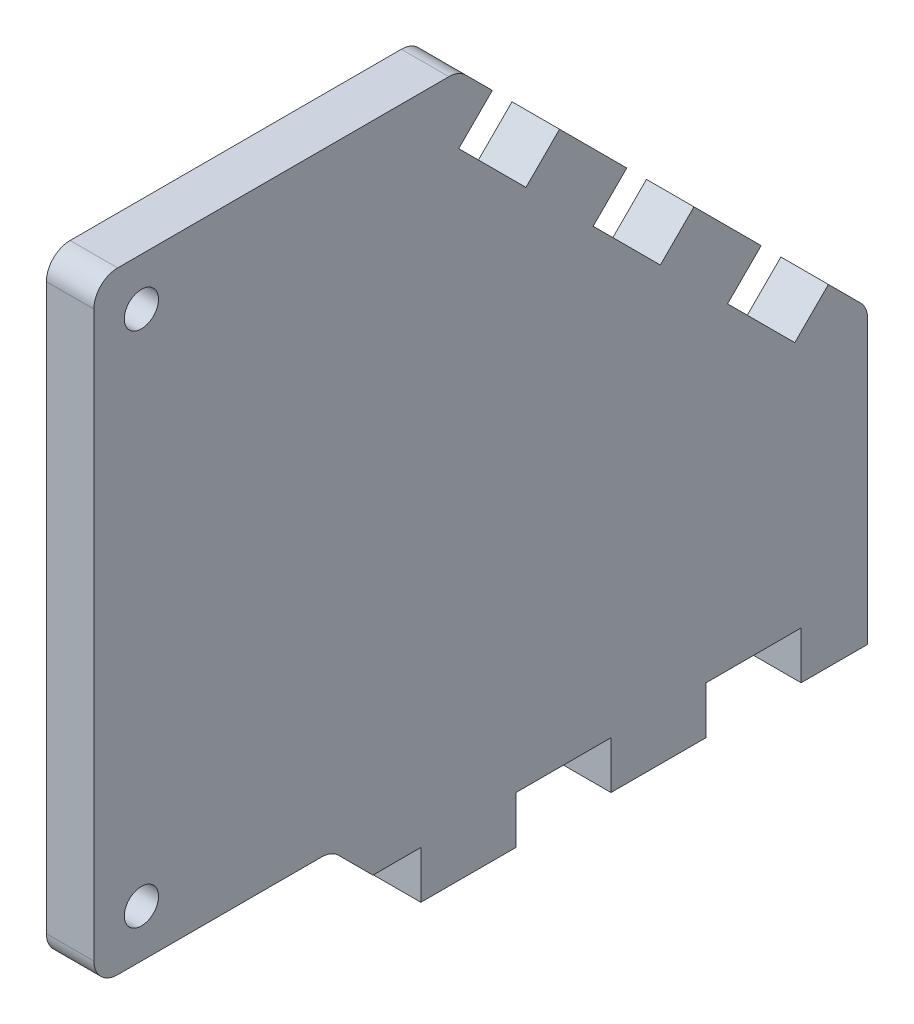
from build123d import *

# Parameters (mm, degrees)
SKETCH2_R           = 2.286
MAIN_DEPTH          = 6.35
SKETCH5_W           = 12.7
SKETCH5_H           = 6.35
SKETCH5_H_2         = 35.219317332
ACRYLIC_JOINT_DEPTH = 123.31992325
SKETCH6_W           = 3.81
SKETCH6_H           = 39.029317332
CUT_EXTRUDE1_DEPTH  = 123.31992325
FILLET4_R           = 3.175


with BuildPart() as part:
    # Sketch2 → Main (new body)
    with BuildSketch(Plane(origin=(0, 0, 0), x_dir=(0, 0, -1), z_dir=(1, 0, 0))):
        Polygon((-67.818, 101.6), (-67.818, 19.812), (-36.068, 19.812), (-29.718, 13.462), (-29.718, 7.9375), (-24.1935, 7.9375), (45.72, 7.9375), (52.07, 7.9375), (52.07, 30.456817332), (-19.073182668, 101.6), (-55.118, 101.6), align=None)
        with Locations((-61.468, 26.162)):
            Circle(SKETCH2_R, mode=Mode.SUBTRACT)
        with Locations((-61.468, 95.25)):
            Circle(SKETCH2_R, mode=Mode.SUBTRACT)
    extrude(amount=MAIN_DEPTH)

    # Sketch5 → Acrylic Joint (cut, through all)
    with BuildSketch(Plane(origin=(6.35, 0, 0), x_dir=(0, 0, -1), z_dir=(1, 0, 0))):
        with Locations((-30.48, 11.1125)):
            Rectangle(SKETCH5_W, SKETCH5_H)
        with Locations((-5.08, 11.1125)):
            Rectangle(SKETCH5_W, SKETCH5_H)
        with Locations((20.32, 11.1125)):
            Rectangle(SKETCH5_W, SKETCH5_H)
        Polygon((16.847841816, 56.698719395), (21.337969877, 61.188847455), (30.318225998, 52.208591334), (25.828097937, 47.718463274), align=None)
        Polygon((-1.112670426, 74.659231637), (3.377457634, 79.149359697), (12.357713756, 70.169103576), (7.867585695, 65.678975516), align=None)
        Polygon((-19.073182668, 92.619743879), (-14.583054608, 97.109871939), (-5.602798487, 88.129615818), (-10.092926547, 83.639487758), align=None)
        with Locations((45.72, 25.547158666)):
            Rectangle(SKETCH5_W, SKETCH5_H_2)
    extrude(amount=-ACRYLIC_JOINT_DEPTH, mode=Mode.SUBTRACT)

    # Sketch6 → Cut-Extrude1 (cut, through all)
    with BuildSketch(Plane(origin=(6.35, 0, 0), x_dir=(0, 0, -1), z_dir=(1, 0, 0))):
        with Locations((37.465, 27.452158666)):
            Rectangle(SKETCH6_W, SKETCH6_H)
    extrude(amount=-CUT_EXTRUDE1_DEPTH, mode=Mode.SUBTRACT)

    # Fillet4
    fillet4_edges = [part.edges().sort_by_distance(p)[0] for p in [
        (3.175, 46.966817332, -35.56),
        (3.175, 19.812, 36.068),
        (3.175, 19.812, 67.818),
        (3.175, 101.6, 67.818),
        (3.175, 101.6, 19.073182668),
    ]]
    fillet(fillet4_edges, radius=FILLET4_R)


solid = part.part
